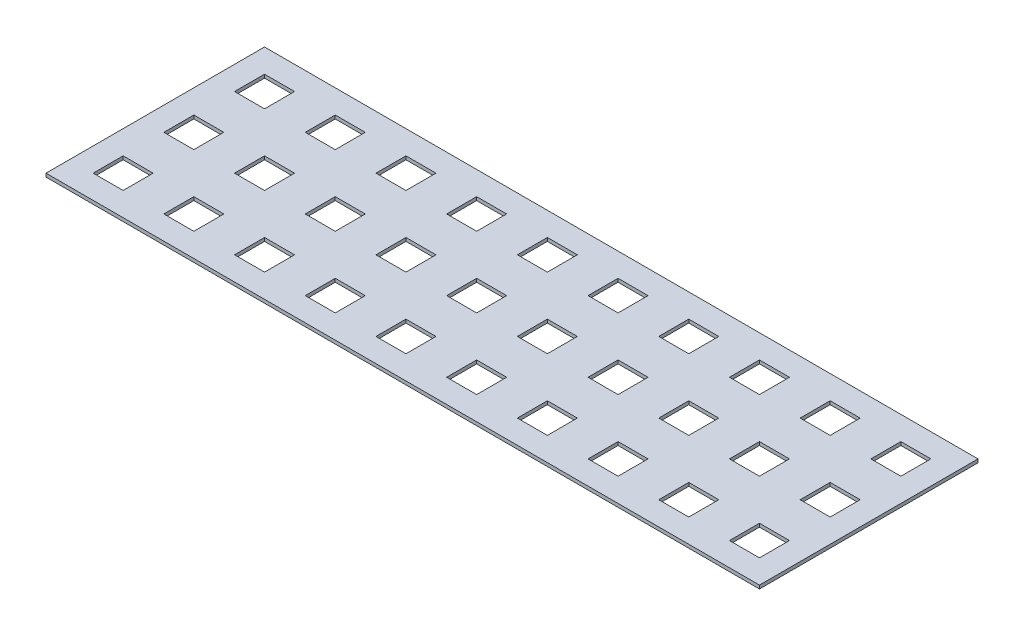
from build123d import *

# Parameters (mm, degrees)
IZIM1_W                     = 166.5
IZIM1_H                     = 51
IZIM1_W_2                   = 7
IZIM1_H_2                   = 7
Y_KSEKLIK_EKSTR_ZYON1_DEPTH = 0.8


with BuildPart() as part:
    # Çizim1 → Yükseklik-Ekstrüzyon1 (new body)
    with BuildSketch(Plane(origin=(0, 0, 0), x_dir=(1, 0, 0), z_dir=(0, 1, 0))):
        with Locations((83.25, 25.5)):
            Rectangle(IZIM1_W, IZIM1_H)
        with Locations((25.5, 42)):
            Rectangle(IZIM1_W_2, IZIM1_H_2, mode=Mode.SUBTRACT)
        with Locations((9, 42)):
            Rectangle(IZIM1_W_2, IZIM1_H_2, mode=Mode.SUBTRACT)
        with Locations((42, 42)):
            Rectangle(IZIM1_W_2, IZIM1_H_2, mode=Mode.SUBTRACT)
        with Locations((58.5, 42)):
            Rectangle(IZIM1_W_2, IZIM1_H_2, mode=Mode.SUBTRACT)
        with Locations((75, 42)):
            Rectangle(IZIM1_W_2, IZIM1_H_2, mode=Mode.SUBTRACT)
        with Locations((91.5, 42)):
            Rectangle(IZIM1_W_2, IZIM1_H_2, mode=Mode.SUBTRACT)
        with Locations((108, 42)):
            Rectangle(IZIM1_W_2, IZIM1_H_2, mode=Mode.SUBTRACT)
        with Locations((124.5, 42)):
            Rectangle(IZIM1_W_2, IZIM1_H_2, mode=Mode.SUBTRACT)
        with Locations((141, 42)):
            Rectangle(IZIM1_W_2, IZIM1_H_2, mode=Mode.SUBTRACT)
        with Locations((157.5, 42)):
            Rectangle(IZIM1_W_2, IZIM1_H_2, mode=Mode.SUBTRACT)
        with Locations((25.5, 25.5)):
            Rectangle(IZIM1_W_2, IZIM1_H_2, mode=Mode.SUBTRACT)
        with Locations((42, 25.5)):
            Rectangle(IZIM1_W_2, IZIM1_H_2, mode=Mode.SUBTRACT)
        with Locations((58.5, 25.5)):
            Rectangle(IZIM1_W_2, IZIM1_H_2, mode=Mode.SUBTRACT)
        with Locations((75, 25.5)):
            Rectangle(IZIM1_W_2, IZIM1_H_2, mode=Mode.SUBTRACT)
        with Locations((91.5, 25.5)):
            Rectangle(IZIM1_W_2, IZIM1_H_2, mode=Mode.SUBTRACT)
        with Locations((108, 25.5)):
            Rectangle(IZIM1_W_2, IZIM1_H_2, mode=Mode.SUBTRACT)
        with Locations((124.5, 25.5)):
            Rectangle(IZIM1_W_2, IZIM1_H_2, mode=Mode.SUBTRACT)
        with Locations((141, 25.5)):
            Rectangle(IZIM1_W_2, IZIM1_H_2, mode=Mode.SUBTRACT)
        with Locations((157.5, 25.5)):
            Rectangle(IZIM1_W_2, IZIM1_H_2, mode=Mode.SUBTRACT)
        with Locations((25.5, 9)):
            Rectangle(IZIM1_W_2, IZIM1_H_2, mode=Mode.SUBTRACT)
        with Locations((42, 9)):
            Rectangle(IZIM1_W_2, IZIM1_H_2, mode=Mode.SUBTRACT)
        with Locations((58.5, 9)):
            Rectangle(IZIM1_W_2, IZIM1_H_2, mode=Mode.SUBTRACT)
        with Locations((75, 9)):
            Rectangle(IZIM1_W_2, IZIM1_H_2, mode=Mode.SUBTRACT)
        with Locations((91.5, 9)):
            Rectangle(IZIM1_W_2, IZIM1_H_2, mode=Mode.SUBTRACT)
        with Locations((108, 9)):
            Rectangle(IZIM1_W_2, IZIM1_H_2, mode=Mode.SUBTRACT)
        with Locations((124.5, 9)):
            Rectangle(IZIM1_W_2, IZIM1_H_2, mode=Mode.SUBTRACT)
        with Locations((141, 9)):
            Rectangle(IZIM1_W_2, IZIM1_H_2, mode=Mode.SUBTRACT)
        with Locations((157.5, 9)):
            Rectangle(IZIM1_W_2, IZIM1_H_2, mode=Mode.SUBTRACT)
        with Locations((9, 25.5)):
            Rectangle(IZIM1_W_2, IZIM1_H_2, mode=Mode.SUBTRACT)
        with Locations((9, 9)):
            Rectangle(IZIM1_W_2, IZIM1_H_2, mode=Mode.SUBTRACT)
    extrude(amount=Y_KSEKLIK_EKSTR_ZYON1_DEPTH)


solid = part.part
